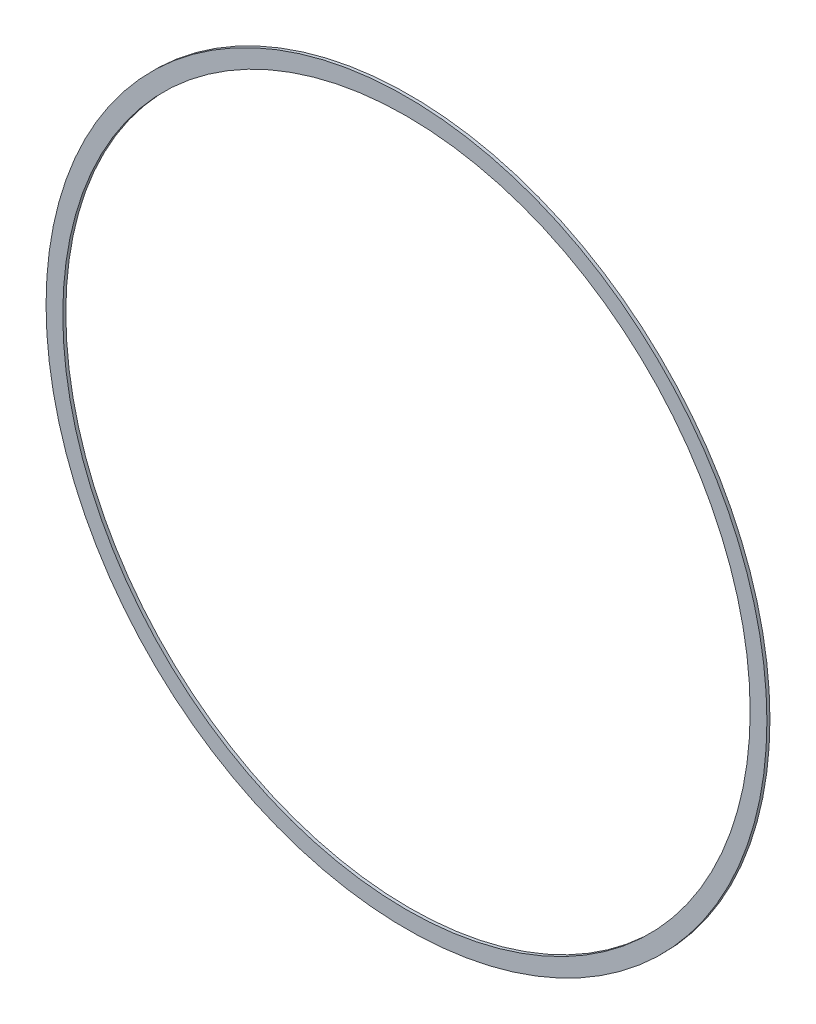
from build123d import *

# Parameters (mm, degrees)
SKETCH1_R           = 237
SKETCH1_R_2         = 226
EXTRUDE_THIN1_DEPTH = 2


with BuildPart() as part:
    # Sketch1 → Extrude-Thin1 (new body)
    with BuildSketch(Plane.XY):
        Circle(SKETCH1_R)
        Circle(SKETCH1_R_2, mode=Mode.SUBTRACT)
    extrude(amount=EXTRUDE_THIN1_DEPTH)


solid = part.part
